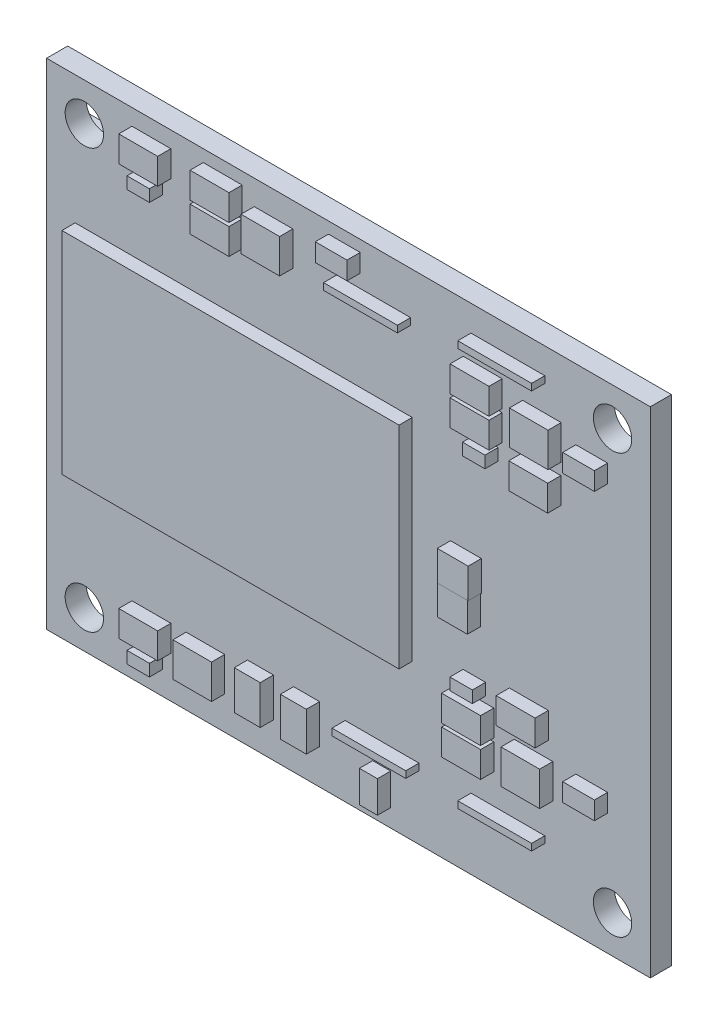
from build123d import *

# Parameters (mm, degrees)
SKETCH1_W                                      = 45.7075
SKETCH1_H                                      = 37.455
BOARD_DEPTH                                    = 1.6
SKETCH2_W                                      = 2.273
SKETCH2_H                                      = 2.3356
HDRV1W64P0_1X1_193X193X447B_1_DEPTH            = 1
SKETCH3_W                                      = 2.3356
SKETCH3_H                                      = 2.273
HDRV1W64P0_1X1_193X193X447B_2_DEPTH            = 1
SKETCH4_W                                      = 2.4
SKETCH4_H                                      = 1.3635
SOD_323F_1_DEPTH                               = 1
SKETCH5_W                                      = 1.3635
SKETCH5_H                                      = 2.4
SOD_323F_2_DEPTH                               = 1
SKETCH6_W                                      = 2.4
SKETCH6_H                                      = 1.3635
SOD_323F_3_DEPTH                               = 1
SKETCH7_W                                      = 2.4
SKETCH7_H                                      = 1.3635
SOD_323F_4_DEPTH                               = 1
SKETCH8_W                                      = 5.588
SKETCH8_H                                      = 0.508
F_1X03_CLEANBIG_1_DEPTH                        = 1
SKETCH9_W                                      = 5.588
SKETCH9_H                                      = 0.508
F_1X03_CLEANBIG_2_DEPTH                        = 1
SKETCH10_W                                     = 5.588
SKETCH10_H                                     = 0.508
F_1X03_CLEANBIG_3_DEPTH                        = 1
SKETCH11_W                                     = 5.588
SKETCH11_H                                     = 0.508
F_1X03_CLEANBIG_4_DEPTH                        = 1
SKETCH12_W                                     = 1.7
SKETCH12_H                                     = 0.9008
CHIP_LED0603_1_DEPTH                           = 1
SKETCH13_W                                     = 1.7
SKETCH13_H                                     = 0.9008
CHIP_LED0603_2_DEPTH                           = 1
SKETCH14_W                                     = 1.7
SKETCH14_H                                     = 0.9008
CHIP_LED0603_3_DEPTH                           = 1
SKETCH15_W                                     = 1.7
SKETCH15_H                                     = 0.9008
CHIP_LED0603_4_DEPTH                           = 1
SKETCH16_W                                     = 2.921
SKETCH16_H                                     = 2.5908
SOT23_1_DEPTH                                  = 1
SKETCH17_W                                     = 2.921
SKETCH17_H                                     = 2.5908
SOT23_2_DEPTH                                  = 1
SKETCH18_W                                     = 2.921
SKETCH18_H                                     = 2.5908
SOT23_3_DEPTH                                  = 1
SKETCH19_W                                     = 2.921
SKETCH19_H                                     = 2.5908
SOT23_4_DEPTH                                  = 1
SKETCH20_W                                     = 2.946
SKETCH20_H                                     = 1.966
EXTRUDE_R0603_1_DEPTH                          = 1
SKETCH21_W                                     = 2.946
SKETCH21_H                                     = 1.966
EXTRUDE_R0603_2_DEPTH                          = 1
SKETCH22_W                                     = 2.946
SKETCH22_H                                     = 1.966
EXTRUDE_R0603_3_DEPTH                          = 1
SKETCH23_W                                     = 1.966
SKETCH23_H                                     = 2.946
EXTRUDE_R0603_4_DEPTH                          = 1
SKETCH24_W                                     = 1.966
SKETCH24_H                                     = 2.946
EXTRUDE_R0603_5_DEPTH                          = 1
SKETCH25_W                                     = 2.946
SKETCH25_H                                     = 1.966
EXTRUDE_R0603_6_DEPTH                          = 1
SKETCH26_W                                     = 2.946
SKETCH26_H                                     = 1.966
EXTRUDE_R0603_7_DEPTH                          = 1
SKETCH27_W                                     = 2.946
SKETCH27_H                                     = 1.966
EXTRUDE_R0603_8_DEPTH                          = 1
SKETCH28_W                                     = 2.946
SKETCH28_H                                     = 1.966
EXTRUDE_R0603_9_DEPTH                          = 1
SKETCH29_W                                     = 2.946
SKETCH29_H                                     = 1.966
EXTRUDE_R0603_10_DEPTH                         = 1
SKETCH30_W                                     = 2.946
SKETCH30_H                                     = 1.966
EXTRUDE_R0603_11_DEPTH                         = 1
SKETCH31_W                                     = 2.946
SKETCH31_H                                     = 1.966
EXTRUDE_R0603_12_DEPTH                         = 1
SKETCH32_W                                     = 25.52
SKETCH32_H                                     = 15.994
HDRVR10W64P254_1X10_2540X254X254B_1_DEPTH      = 1
SKETCH33_W                                     = 39.49
SKETCH33_H                                     = 26.214
HDRVR16W64P2286X254_2X8_2032X2540X254B_1_DEPTH = 1
SKETCH34_W                                     = 3.354
SKETCH34_H                                     = 15.36
HDRVR6W64P254_1X6_1524X254X762B_1_DEPTH        = 1
SKETCH35_R                                     = 1.45288
CUT_EXTRUDE1_DEPTH                             = 57.879497734


with BuildPart() as part:
    # Sketch1 → BOARD (new body)
    with BuildSketch(Plane.XY):
        with Locations((22.21875, 15.87)):
            Rectangle(SKETCH1_W, SKETCH1_H)
    extrude(amount=BOARD_DEPTH)

    # Sketch35 → Cut-Extrude1 (cut, through all)
    with BuildSketch(Plane.XY.offset(1.6)):
        with Locations((2.2225, 31.74)):
            Circle(SKETCH35_R)
        with Locations((42.215, 31.74)):
            Circle(SKETCH35_R)
        with Locations((42.215, 0)):
            Circle(SKETCH35_R)
        with Locations((2.2225, 0)):
            Circle(SKETCH35_R)
    extrude(amount=-CUT_EXTRUDE1_DEPTH, mode=Mode.SUBTRACT)


with BuildPart() as body_2:
    # Sketch2 → HDRV1W64P0_1X1_193X193X447B-1 (new body)
    with BuildSketch(Plane.XY.offset(1.6)):
        with Locations((31.085, 14.9225)):
            Rectangle(SKETCH2_W, SKETCH2_H)
    extrude(amount=HDRV1W64P0_1X1_193X193X447B_1_DEPTH)


with BuildPart() as body_3:
    # Sketch3 → HDRV1W64P0_1X1_193X193X447B-2 (new body)
    with BuildSketch(Plane.XY.offset(1.6)):
        with Locations((31.115, 17.115)):
            Rectangle(SKETCH3_W, SKETCH3_H)
    extrude(amount=HDRV1W64P0_1X1_193X193X447B_2_DEPTH)


with BuildPart() as body_4:
    # Sketch4 → SOD-323F-1 (new body)
    with BuildSketch(Plane.XY.offset(1.6)):
        with Locations((21.9075, 33.05175)):
            Rectangle(SKETCH4_W, SKETCH4_H)
    extrude(amount=SOD_323F_1_DEPTH)


with BuildPart() as body_5:
    # Sketch5 → SOD-323F-2 (new body)
    with BuildSketch(Plane.XY.offset(1.6)):
        with Locations((24.73325, -0.3175)):
            Rectangle(SKETCH5_W, SKETCH5_H)
    extrude(amount=SOD_323F_2_DEPTH)


with BuildPart() as body_6:
    # Sketch6 → SOD-323F-3 (new body)
    with BuildSketch(Plane.XY.offset(1.6)):
        with Locations((40.64, 28.60675)):
            Rectangle(SKETCH6_W, SKETCH6_H)
    extrude(amount=SOD_323F_3_DEPTH)


with BuildPart() as body_7:
    # Sketch7 → SOD-323F-4 (new body)
    with BuildSketch(Plane.XY.offset(1.6)):
        with Locations((40.64, 7.01675)):
            Rectangle(SKETCH7_W, SKETCH7_H)
    extrude(amount=SOD_323F_4_DEPTH)


with BuildPart() as body_8:
    # Sketch8 → 1X03-CLEANBIG-1 (new body)
    with BuildSketch(Plane.XY.offset(1.6)):
        with Locations((24.13, 31.115)):
            Rectangle(SKETCH8_W, SKETCH8_H)
    extrude(amount=F_1X03_CLEANBIG_1_DEPTH)


with BuildPart() as body_9:
    # Sketch9 → 1X03-CLEANBIG-2 (new body)
    with BuildSketch(Plane.XY.offset(1.6)):
        with Locations((24.765, 2.2225)):
            Rectangle(SKETCH9_W, SKETCH9_H)
    extrude(amount=F_1X03_CLEANBIG_2_DEPTH)


with BuildPart() as body_10:
    # Sketch10 → 1X03-CLEANBIG-3 (new body)
    with BuildSketch(Plane.XY.offset(1.6)):
        with Locations((34.29, 32.385)):
            Rectangle(SKETCH10_W, SKETCH10_H)
    extrude(amount=F_1X03_CLEANBIG_3_DEPTH)


with BuildPart() as body_11:
    # Sketch11 → 1X03-CLEANBIG-4 (new body)
    with BuildSketch(Plane.XY.offset(1.6)):
        with Locations((34.29, 2.2225)):
            Rectangle(SKETCH11_W, SKETCH11_H)
    extrude(amount=F_1X03_CLEANBIG_4_DEPTH)


with BuildPart() as body_12:
    # Sketch12 → CHIP-LED0603-1 (new body)
    with BuildSketch(Plane.XY.offset(1.6)):
        with Locations((7.3025, 30.4804)):
            Rectangle(SKETCH12_W, SKETCH12_H)
    extrude(amount=CHIP_LED0603_1_DEPTH)


with BuildPart() as body_13:
    # Sketch13 → CHIP-LED0603-2 (new body)
    with BuildSketch(Plane.XY.offset(1.6)):
        with Locations((7.3025, -0.6346)):
            Rectangle(SKETCH13_W, SKETCH13_H)
    extrude(amount=CHIP_LED0603_2_DEPTH)


with BuildPart() as body_14:
    # Sketch14 → CHIP-LED0603-3 (new body)
    with BuildSketch(Plane.XY.offset(1.6)):
        with Locations((32.7025, 25.7171)):
            Rectangle(SKETCH14_W, SKETCH14_H)
    extrude(amount=CHIP_LED0603_3_DEPTH)


with BuildPart() as body_15:
    # Sketch15 → CHIP-LED0603-4 (new body)
    with BuildSketch(Plane.XY.offset(1.6)):
        with Locations((31.75, 9.8421)):
            Rectangle(SKETCH15_W, SKETCH15_H)
    extrude(amount=CHIP_LED0603_4_DEPTH)


with BuildPart() as body_16:
    # Sketch16 → SOT23-1 (new body)
    with BuildSketch(Plane.XY.offset(1.6)):
        with Locations((16.5481, 31.4325)):
            Rectangle(SKETCH16_W, SKETCH16_H)
    extrude(amount=SOT23_1_DEPTH)


with BuildPart() as body_17:
    # Sketch17 → SOT23-2 (new body)
    with BuildSketch(Plane.XY.offset(1.6)):
        with Locations((11.3919, 0.9525)):
            Rectangle(SKETCH17_W, SKETCH17_H)
    extrude(amount=SOT23_2_DEPTH)


with BuildPart() as body_18:
    # Sketch18 → SOT23-3 (new body)
    with BuildSketch(Plane.XY.offset(1.6)):
        with Locations((36.8681, 28.8925)):
            Rectangle(SKETCH18_W, SKETCH18_H)
    extrude(amount=SOT23_3_DEPTH)


with BuildPart() as body_19:
    # Sketch19 → SOT23-4 (new body)
    with BuildSketch(Plane.XY.offset(1.6)):
        with Locations((36.2331, 6.35)):
            Rectangle(SKETCH19_W, SKETCH19_H)
    extrude(amount=SOT23_4_DEPTH)


with BuildPart() as body_20:
    # Sketch20 → Extrude R0603-1 (new body)
    with BuildSketch(Plane.XY.offset(1.6)):
        with Locations((12.7, 30.48)):
            Rectangle(SKETCH20_W, SKETCH20_H)
    extrude(amount=EXTRUDE_R0603_1_DEPTH)


with BuildPart() as body_21:
    # Sketch21 → Extrude R0603-2 (new body)
    with BuildSketch(Plane.XY.offset(1.6)):
        with Locations((12.7, 32.7025)):
            Rectangle(SKETCH21_W, SKETCH21_H)
    extrude(amount=EXTRUDE_R0603_2_DEPTH)


with BuildPart() as body_22:
    # Sketch22 → Extrude R0603-3 (new body)
    with BuildSketch(Plane.XY.offset(1.6)):
        with Locations((7.3025, 32.385)):
            Rectangle(SKETCH22_W, SKETCH22_H)
    extrude(amount=EXTRUDE_R0603_3_DEPTH)


with BuildPart() as body_23:
    # Sketch23 → Extrude R0603-4 (new body)
    with BuildSketch(Plane.XY.offset(1.6)):
        with Locations((19.05, 1.27)):
            Rectangle(SKETCH23_W, SKETCH23_H)
    extrude(amount=EXTRUDE_R0603_4_DEPTH)


with BuildPart() as body_24:
    # Sketch24 → Extrude R0603-5 (new body)
    with BuildSketch(Plane.XY.offset(1.6)):
        with Locations((15.5575, 1.27)):
            Rectangle(SKETCH24_W, SKETCH24_H)
    extrude(amount=EXTRUDE_R0603_5_DEPTH)


with BuildPart() as body_25:
    # Sketch25 → Extrude R0603-6 (new body)
    with BuildSketch(Plane.XY.offset(1.6)):
        with Locations((7.3025, 1.27)):
            Rectangle(SKETCH25_W, SKETCH25_H)
    extrude(amount=EXTRUDE_R0603_6_DEPTH)


with BuildPart() as body_26:
    # Sketch26 → Extrude R0603-7 (new body)
    with BuildSketch(Plane.XY.offset(1.6)):
        with Locations((32.385, 29.845)):
            Rectangle(SKETCH26_W, SKETCH26_H)
    extrude(amount=EXTRUDE_R0603_7_DEPTH)


with BuildPart() as body_27:
    # Sketch27 → Extrude R0603-8 (new body)
    with BuildSketch(Plane.XY.offset(1.6)):
        with Locations((36.83, 25.7175)):
            Rectangle(SKETCH27_W, SKETCH27_H)
    extrude(amount=EXTRUDE_R0603_8_DEPTH)


with BuildPart() as body_28:
    # Sketch28 → Extrude R0603-9 (new body)
    with BuildSketch(Plane.XY.offset(1.6)):
        with Locations((32.385, 27.6225)):
            Rectangle(SKETCH28_W, SKETCH28_H)
    extrude(amount=EXTRUDE_R0603_9_DEPTH)


with BuildPart() as body_29:
    # Sketch29 → Extrude R0603-10 (new body)
    with BuildSketch(Plane.XY.offset(1.6)):
        with Locations((31.75, 5.715)):
            Rectangle(SKETCH29_W, SKETCH29_H)
    extrude(amount=EXTRUDE_R0603_10_DEPTH)


with BuildPart() as body_30:
    # Sketch30 → Extrude R0603-11 (new body)
    with BuildSketch(Plane.XY.offset(1.6)):
        with Locations((35.8775, 9.8425)):
            Rectangle(SKETCH30_W, SKETCH30_H)
    extrude(amount=EXTRUDE_R0603_11_DEPTH)


with BuildPart() as body_31:
    # Sketch31 → Extrude R0603-12 (new body)
    with BuildSketch(Plane.XY.offset(1.6)):
        with Locations((31.75, 7.9375)):
            Rectangle(SKETCH31_W, SKETCH31_H)
    extrude(amount=EXTRUDE_R0603_12_DEPTH)


with BuildPart() as body_32:
    # Sketch32 → HDRVR10W64P254_1X10_2540X254X254B-1 (new body)
    with BuildSketch(Plane.XY.offset(1.6)):
        with Locations((14.2875, 16.887)):
            Rectangle(SKETCH32_W, SKETCH32_H)
    extrude(amount=HDRVR10W64P254_1X10_2540X254X254B_1_DEPTH)


with BuildPart() as body_33:
    # Sketch33 → HDRVR16W64P2286X254_2X8_2032X2540X254B-1 (new body)
    with BuildSketch(Plane.XY):
        with Locations((19.05, 16.857)):
            Rectangle(SKETCH33_W, SKETCH33_H)
    extrude(amount=-HDRVR16W64P2286X254_2X8_2032X2540X254B_1_DEPTH)


with BuildPart() as body_34:
    # Sketch34 → HDRVR6W64P254_1X6_1524X254X762B-1 (new body)
    with BuildSketch(Plane.XY):
        with Locations((41.563, 16.8275)):
            Rectangle(SKETCH34_W, SKETCH34_H)
    extrude(amount=-HDRVR6W64P254_1X6_1524X254X762B_1_DEPTH)


solid = Compound([part.part, body_2.part, body_3.part, body_4.part, body_5.part, body_6.part, body_7.part, body_8.part, body_9.part, body_10.part, body_11.part, body_12.part, body_13.part, body_14.part, body_15.part, body_16.part, body_17.part, body_18.part, body_19.part, body_20.part, body_21.part, body_22.part, body_23.part, body_24.part, body_25.part, body_26.part, body_27.part, body_28.part, body_29.part, body_30.part, body_31.part, body_32.part, body_33.part, body_34.part])
